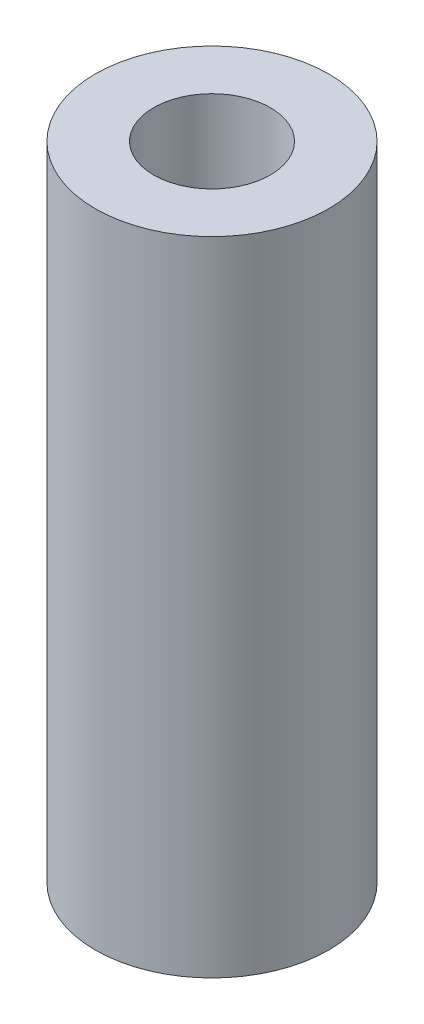
from build123d import *

# Parameters (mm, degrees)
SKETCH1_R           = 6.35
SKETCH1_R_2         = 3.175
BOSS_EXTRUDE1_DEPTH = 34.925


with BuildPart() as part:
    # Sketch1 → Boss-Extrude1 (new body)
    with BuildSketch(Plane(origin=(0, 0, 0), x_dir=(1, 0, 0), z_dir=(0, 1, 0))):
        with Locations(Location((0, 0, 0), (0, 0, 270))):
            Circle(SKETCH1_R)
        with Locations(Location((0, 0, 0), (0, 0, 270))):
            Circle(SKETCH1_R_2, mode=Mode.SUBTRACT)
    extrude(amount=BOSS_EXTRUDE1_DEPTH)


solid = part.part
